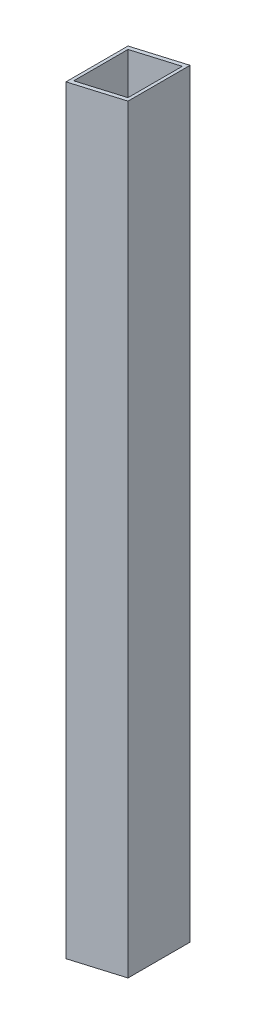
from build123d import *

# Parameters (mm, degrees)
CROQUIS1_W              = 76.2
CROQUIS1_H              = 76.2
CROQUIS1_W_2            = 66.675
CROQUIS1_H_2            = 66.675
SALIENTE_EXTRUIR1_DEPTH = 950
CORTAR_EXTRUIR1_REACH   = 958.093
CORTAR_EXTRUIR2_DEPTH   = 76.2


with BuildPart() as part:
    # Croquis1 → Saliente-Extruir1 (new body)
    with BuildSketch(Plane(origin=(0, 0, 0), x_dir=(1, 0, 0), z_dir=(0, 1, 0))):
        with Locations((38.1, -38.1)):
            Rectangle(CROQUIS1_W, CROQUIS1_H)
        with Locations((38.1, -38.1)):
            Rectangle(CROQUIS1_W_2, CROQUIS1_H_2, mode=Mode.SUBTRACT)
    extrude(amount=SALIENTE_EXTRUIR1_DEPTH)

    # Cortar-Extruir1: up to this face of the body (flat: up to its plane)
    cortar_extruir1_end = Plane(part.part.faces().sort_by_distance((38.1, 475, 0))[0])
    # Croquis2 → Cortar-Extruir1 (cut, up to the picked face)
    with BuildSketch(Plane.XY.offset(76.2), mode=Mode.PRIVATE) as cortar_extruir1_sk1:
        Polygon((0, 0), (76.2, 17.592156164), (76.2, 0), align=None)
    cortar_extruir1_tool1 = split(extrude(cortar_extruir1_sk1.sketch, amount=-CORTAR_EXTRUIR1_REACH, mode=Mode.PRIVATE), bisect_by=cortar_extruir1_end, keep=Keep.BOTH, mode=Mode.PRIVATE)
    add(cortar_extruir1_tool1.solids().sort_by(Axis((50.8, 5.864052, 76.2), (0, 0, -1)))[0], mode=Mode.SUBTRACT)

    # Croquis3 → Cortar-Extruir2 (cut)
    with BuildSketch(Plane.XY.offset(76.2)):
        Polygon((76.2, 950), (0, 932.407843836), (0, 950), align=None)
    extrude(amount=-CORTAR_EXTRUIR2_DEPTH, mode=Mode.SUBTRACT)


solid = part.part
